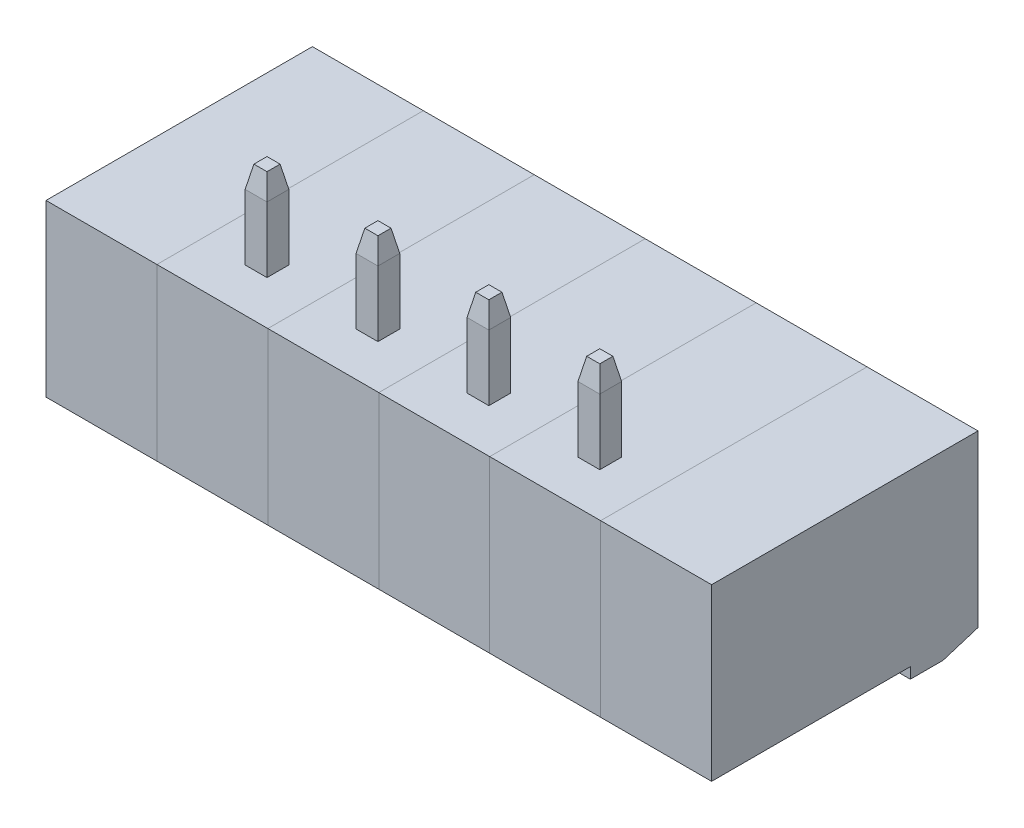
from build123d import *
from OCP.BRepFilletAPI import BRepFilletAPI_MakeChamfer

# Parameters (mm, degrees)
EXTRUDE_1_DEPTH        = 5.08
SKETCH_2_R             = 0.9
CUT_EXTRUDE_1_DEPTH    = 5.08
EXTRUDE_2_DEPTH        = 5.08
SKETCH_3_W             = 1
SKETCH_3_H             = 1
CUT_EXTRUDE_2_DEPTH    = 8
SKETCH_4_W             = 1
SKETCH_4_H             = 1
EXTRUDE_3_DEPTH        = 4
CHAMFER_1_SIZE         = 1
CHAMFER_1_SIZE2        = 0.2
PATTERN_LINEAR_1_COUNT = 4
PATTERN_LINEAR_1_PITCH = 5.08


with BuildPart() as part:
    # 草图1 → 凸台-拉伸1 (new body)
    with BuildSketch(Plane(origin=(0, 0, 0), x_dir=(0, 1, 0), z_dir=(-1, 0, 0))):
        Polygon((-3.9, -6.1), (3.9, -6.1), (3.9, 6.1), (-3.9, 6.1), (-4.4, 4.5), (-4.4, 3), (-3.9, 3), align=None)
    extrude(amount=EXTRUDE_1_DEPTH)

    # 草图2 → 切除-拉伸1 (cut)
    with BuildSketch(Plane(origin=(0, 0, -6.1), x_dir=(-1, 0, 0), z_dir=(0, 0, -1))):
        with Locations((2.54, 0)):
            Circle(SKETCH_2_R)
    extrude(amount=-CUT_EXTRUDE_1_DEPTH, mode=Mode.SUBTRACT)


with BuildPart() as body_2:
    # 草图1<4> → 凸台-拉伸2 (new body)
    with BuildSketch(Plane(origin=(0, 0, 0), x_dir=(0, 1, 0), z_dir=(-1, 0, 0))):
        Polygon((-3.9, -6.1), (3.9, -6.1), (3.9, 6.1), (-3.9, 6.1), (-4.4, 4.5), (-4.4, 3), (-3.9, 3), align=None)
    extrude(amount=-EXTRUDE_2_DEPTH)

    # 草图3 → 切除-拉伸2 (cut)
    with BuildSketch(Plane(origin=(0, 0, -6.1), x_dir=(-1, 0, 0), z_dir=(0, 0, -1))):
        with BuildLine():
            Line((0, 2.5), (-0.7, 2.5))
            ThreePointArc((-0.7, 2.5), (-2.54, 3.1), (-4.38, 2.5))
            Line((-4.38, 2.5), (-5.08, 2.5))
            Line((-5.08, 2.5), (-5.08, -2.7))
            Line((-5.08, -2.7), (0, -2.7))
            Line((0, -2.7), (0, 2.5))
        make_face()
        with Locations((-2.54, 0)):
            Rectangle(SKETCH_3_W, SKETCH_3_H, mode=Mode.SUBTRACT)
    extrude(amount=-CUT_EXTRUDE_2_DEPTH, mode=Mode.SUBTRACT)

    # 草图4 → 凸台-拉伸3 (add)
    with BuildSketch(Plane(origin=(0, 3.9, 0), x_dir=(1, 0, 0), z_dir=(0, 1, 0))):
        with Locations((2.54, -3.6)):
            Rectangle(SKETCH_4_W, SKETCH_4_H)
    extrude(amount=EXTRUDE_3_DEPTH)

    # 倒角1: one chamfer whose edges measure the first distance from different faces: ONE call of the kernel's chamfer builder (chamfer() names one face for all edges)
    chamfer_1_edges_1 = [body_2.edges().sort_by_distance(p)[0] for p in [
        (3.04, 0, -6.1),
    ]]
    chamfer_1_side_1 = [body_2.faces().sort_by_distance(p)[0] for p in [
        (3.04, 0, -2.1),
    ]]
    chamfer_1_edges_2 = [body_2.edges().sort_by_distance(p)[0] for p in [
        (2.54, 0.5, -6.1),
    ]]
    chamfer_1_side_2 = [body_2.faces().sort_by_distance(p)[0] for p in [
        (2.54, 0.5, -2.1),
    ]]
    chamfer_1_edges_3 = [body_2.edges().sort_by_distance(p)[0] for p in [
        (2.04, 0, -6.1),
    ]]
    chamfer_1_side_3 = [body_2.faces().sort_by_distance(p)[0] for p in [
        (2.04, 0, -2.1),
    ]]
    chamfer_1_edges_4 = [body_2.edges().sort_by_distance(p)[0] for p in [
        (2.54, -0.5, -6.1),
    ]]
    chamfer_1_side_4 = [body_2.faces().sort_by_distance(p)[0] for p in [
        (2.54, -0.5, -2.1),
    ]]
    chamfer_1_edges_5 = [body_2.edges().sort_by_distance(p)[0] for p in [
        (3.04, 7.9, 3.6),
    ]]
    chamfer_1_side_5 = [body_2.faces().sort_by_distance(p)[0] for p in [
        (3.04, 5.9, 3.6),
    ]]
    chamfer_1_edges_6 = [body_2.edges().sort_by_distance(p)[0] for p in [
        (2.54, 7.9, 3.1),
    ]]
    chamfer_1_side_6 = [body_2.faces().sort_by_distance(p)[0] for p in [
        (2.54, 5.9, 3.1),
    ]]
    chamfer_1_edges_7 = [body_2.edges().sort_by_distance(p)[0] for p in [
        (2.04, 7.9, 3.6),
    ]]
    chamfer_1_side_7 = [body_2.faces().sort_by_distance(p)[0] for p in [
        (2.04, 5.9, 3.6),
    ]]
    chamfer_1_edges_8 = [body_2.edges().sort_by_distance(p)[0] for p in [
        (2.54, 7.9, 4.1),
    ]]
    chamfer_1_side_8 = [body_2.faces().sort_by_distance(p)[0] for p in [
        (2.54, 5.9, 4.1),
    ]]
    chamfer_1 = BRepFilletAPI_MakeChamfer(body_2.part.solid().wrapped)
    for e in chamfer_1_edges_1:
        chamfer_1.Add(CHAMFER_1_SIZE, CHAMFER_1_SIZE2, e.wrapped, chamfer_1_side_1[0].wrapped)  # the first distance lies on this face
    for e in chamfer_1_edges_2:
        chamfer_1.Add(CHAMFER_1_SIZE, CHAMFER_1_SIZE2, e.wrapped, chamfer_1_side_2[0].wrapped)  # the first distance lies on this face
    for e in chamfer_1_edges_3:
        chamfer_1.Add(CHAMFER_1_SIZE, CHAMFER_1_SIZE2, e.wrapped, chamfer_1_side_3[0].wrapped)  # the first distance lies on this face
    for e in chamfer_1_edges_4:
        chamfer_1.Add(CHAMFER_1_SIZE, CHAMFER_1_SIZE2, e.wrapped, chamfer_1_side_4[0].wrapped)  # the first distance lies on this face
    for e in chamfer_1_edges_5:
        chamfer_1.Add(CHAMFER_1_SIZE, CHAMFER_1_SIZE2, e.wrapped, chamfer_1_side_5[0].wrapped)  # the first distance lies on this face
    for e in chamfer_1_edges_6:
        chamfer_1.Add(CHAMFER_1_SIZE, CHAMFER_1_SIZE2, e.wrapped, chamfer_1_side_6[0].wrapped)  # the first distance lies on this face
    for e in chamfer_1_edges_7:
        chamfer_1.Add(CHAMFER_1_SIZE, CHAMFER_1_SIZE2, e.wrapped, chamfer_1_side_7[0].wrapped)  # the first distance lies on this face
    for e in chamfer_1_edges_8:
        chamfer_1.Add(CHAMFER_1_SIZE, CHAMFER_1_SIZE2, e.wrapped, chamfer_1_side_8[0].wrapped)  # the first distance lies on this face
    add(Compound.cast(chamfer_1.Shape()), mode=Mode.REPLACE)


with BuildPart() as pattern_linear_1_1:
    # 阵列(线性)1: pattern copy
    add(body_2.part.moved(Location(Vector(1, 0, 0) * (1 * PATTERN_LINEAR_1_PITCH))))


with BuildPart() as pattern_linear_1_2:
    # 阵列(线性)1: pattern copy
    add(body_2.part.moved(Location(Vector(1, 0, 0) * (2 * PATTERN_LINEAR_1_PITCH))))


with BuildPart() as pattern_linear_1_3:
    # 阵列(线性)1: pattern copy
    add(body_2.part.moved(Location(Vector(1, 0, 0) * (3 * PATTERN_LINEAR_1_PITCH))))


with BuildPart() as body_6:
    # 镜向1: mirrored copy
    add(part.part.mirror(Plane(origin=(10.16, 0, 0), x_dir=(0, 0, 1), z_dir=(1, 0, 0))))


solid = Compound([part.part, body_2.part, pattern_linear_1_1.part, pattern_linear_1_2.part, pattern_linear_1_3.part, body_6.part])
